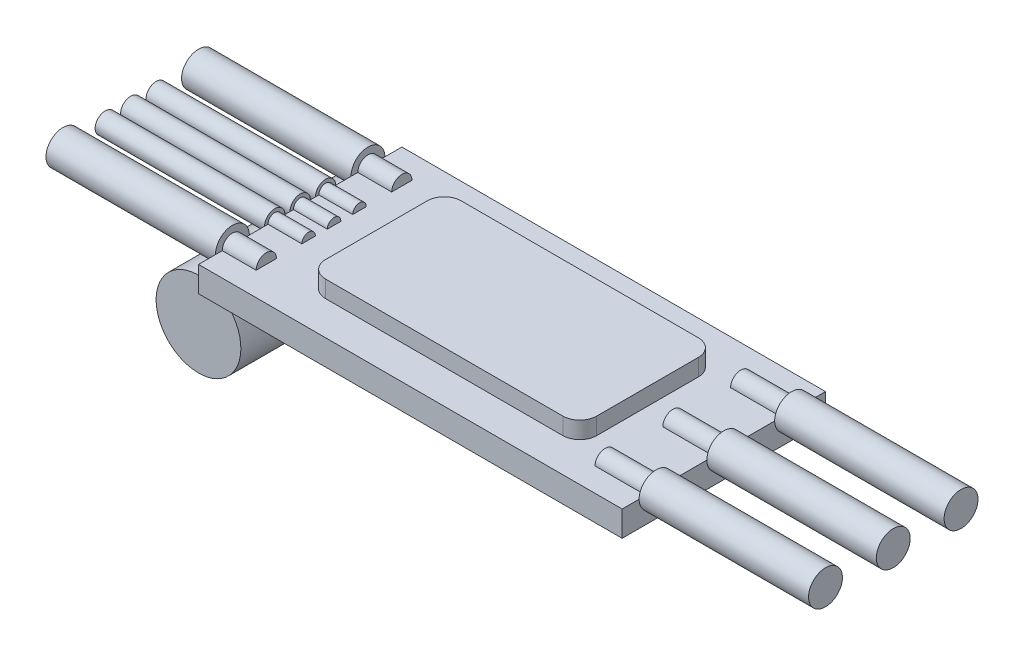
from build123d import *

# Parameters (mm, degrees)
SKETCH1_W            = 25
SKETCH1_H            = 12
BOSS_EXTRUDE1_DEPTH  = 1.5
SKETCH2_R            = 1
BOSS_EXTRUDE2_DEPTH  = 10
SKETCH3_R            = 0.6
BOSS_EXTRUDE3_DEPTH  = 3
BOSS_EXTRUDE4_START  = 10
SKETCH4_R            = 1
SKETCH4_R_2          = 0.6
BOSS_EXTRUDE4_DEPTH  = 10
BOSS_EXTRUDE5_START  = 2
SKETCH5_R            = 0.6
SKETCH5_R_2          = 0.4
BOSS_EXTRUDE5_DEPTH  = 2
BOSS_EXTRUDE6_DEPTH  = 1
SKETCH8_R            = 2.5
BOSS_EXTRUDE10_DEPTH = 11
SKETCH9_W            = 6.362334076
SKETCH9_H            = 5.27029166
BOSS_EXTRUDE11_DEPTH = 1
SKETCH10_W           = 1.899204201
SKETCH10_H           = 1.329442941
SKETCH10_W_2         = 1.614323571
SKETCH10_H_2         = 2.374005252
SKETCH10_W_3         = 3.418567563
SKETCH10_H_3         = 0.85464189
SKETCH10_W_4         = 1.139522521
SKETCH10_W_5         = 1.234482731
SKETCH10_H_4         = 1.804243992
SKETCH10_W_6         = 1.351356835
SKETCH10_W_7         = 3.250561037
SKETCH10_H_5         = 1.187002626
BOSS_EXTRUDE12_DEPTH = 0.8


with BuildPart() as part:
    # Sketch1 → Boss-Extrude1 (new body)
    with BuildSketch(Plane(origin=(0, 0, 0), x_dir=(1, 0, 0), z_dir=(0, 1, 0))):
        Rectangle(SKETCH1_W, SKETCH1_H)
    extrude(amount=BOSS_EXTRUDE1_DEPTH)

    # Sketch2 → Boss-Extrude2 (add)
    with BuildSketch(Plane(origin=(12.5, 0, 0), x_dir=(0, 0, -1), z_dir=(1, 0, 0))):
        with Locations((0, 1.5)):
            Circle(SKETCH2_R)
        with Locations((-4, 1.5)):
            Circle(SKETCH2_R)
        with Locations((4, 1.5)):
            Circle(SKETCH2_R)
    extrude(amount=BOSS_EXTRUDE2_DEPTH)

    # Sketch3 → Boss-Extrude3 (add)
    with BuildSketch(Plane(origin=(12.5, 0, 0), x_dir=(0, 0, -1), z_dir=(1, 0, 0))):
        with Locations((-4, 1.5)):
            Circle(SKETCH3_R)
        with Locations((0, 1.5)):
            Circle(SKETCH3_R)
        with Locations((4, 1.5)):
            Circle(SKETCH3_R)
    extrude(amount=-BOSS_EXTRUDE3_DEPTH)

    # Sketch4 → Boss-Extrude4 (add)
    with BuildSketch(Plane.ZY.offset(12.5).offset(BOSS_EXTRUDE4_START)):
        with Locations(Location((-4, 1.5, 0), (0, 0, 180))):
            Circle(SKETCH4_R)
        with Locations(Location((4, 1.5, 0), (0, 0, 180))):
            Circle(SKETCH4_R)
        with Locations((0, 1.5)):
            Circle(SKETCH4_R_2)
        with Locations((1.5, 1.5)):
            Circle(SKETCH4_R_2)
        with Locations((-1.5, 1.5)):
            Circle(SKETCH4_R_2)
    extrude(amount=-BOSS_EXTRUDE4_DEPTH)

    # Sketch5 → Boss-Extrude5 (add)
    with BuildSketch(Plane(origin=(-12.5, 0, 0), x_dir=(0, 0, -1), z_dir=(1, 0, 0)).offset(BOSS_EXTRUDE5_START)):
        with Locations((-4, 1.5)):
            Circle(SKETCH5_R)
        with Locations((-1.5, 1.5)):
            Circle(SKETCH5_R_2)
        with Locations((0, 1.5)):
            Circle(SKETCH5_R_2)
        with Locations((1.5, 1.5)):
            Circle(SKETCH5_R_2)
        with Locations((4, 1.5)):
            Circle(SKETCH5_R)
    extrude(amount=-BOSS_EXTRUDE5_DEPTH)

    # Sketch6 → Boss-Extrude6 (add)
    with BuildSketch(Plane(origin=(0, 1.5, 0), x_dir=(1, 0, 0), z_dir=(0, 1, 0))):
        with BuildLine():
            Line((-7, -4), (7, -4))
            ThreePointArc((7, -4), (7.707106781, -3.707106781), (8, -3))
            Line((8, -3), (8, 3))
            ThreePointArc((8, 3), (7.707106781, 3.707106781), (7, 4))
            Line((7, 4), (-7, 4))
            ThreePointArc((-7, 4), (-7.707106781, 3.707106781), (-8, 3))
            Line((-8, 3), (-8, -3))
            ThreePointArc((-8, -3), (-7.707106781, -3.707106781), (-7, -4))
        make_face()
    extrude(amount=BOSS_EXTRUDE6_DEPTH)

    # Sketch8 → Boss-Extrude10 (add)
    with BuildSketch(Plane.XY.offset(5.5)):
        with Locations((-13, -2.05)):
            Circle(SKETCH8_R)
    extrude(amount=-BOSS_EXTRUDE10_DEPTH)

    # Sketch9 → Boss-Extrude11 (add)
    with BuildSketch(Plane.XZ):
        Rectangle(SKETCH9_W, SKETCH9_H)
    extrude(amount=BOSS_EXTRUDE11_DEPTH)

    # Sketch10 → Boss-Extrude12 (add)
    with BuildSketch(Plane.XZ):
        with Locations((-8.688859223, 3.347347405)):
            Rectangle(SKETCH10_W, SKETCH10_H)
        with Locations((-7.406896386, -1.780503939)):
            Rectangle(SKETCH10_W_2, SKETCH10_H_2)
        with Locations((1.471883257, -3.917108666)):
            Rectangle(SKETCH10_W_3, SKETCH10_H_3)
        with Locations((4.415649769, -1.780503939)):
            Rectangle(SKETCH10_W_4, SKETCH10_H_2)
        with Locations((5.887533026, 4.012068876)):
            Rectangle(SKETCH10_W_5, SKETCH10_H_4)
        with Locations((7.823260385, 4.012068876)):
            Rectangle(SKETCH10_W_6, SKETCH10_H_4)
        with Locations((7.823260385, 0)):
            Rectangle(SKETCH10_W_7, SKETCH10_H_5)
    extrude(amount=BOSS_EXTRUDE12_DEPTH)


solid = part.part
